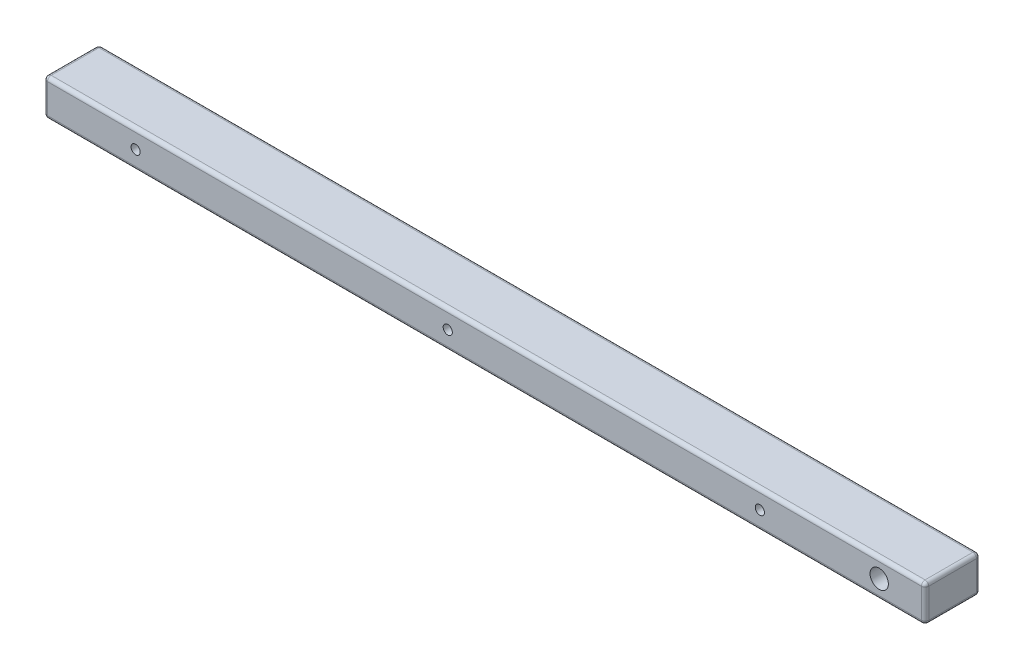
from build123d import *

# Parameters (mm, degrees)
SKETCH1_W           = 480
SKETCH1_H           = 20
BOSS_EXTRUDE1_DEPTH = 30
FILLET1_R           = 2
SKETCH2_R           = 5
CUT_EXTRUDE1_DEPTH  = 30
SKETCH7_R           = 2.5
CUT_EXTRUDE4_DEPTH  = 30


with BuildPart() as part:
    # Sketch1 → Boss-Extrude1 (new body)
    with BuildSketch(Plane.XY):
        with Locations((0, 10)):
            Rectangle(SKETCH1_W, SKETCH1_H)
    extrude(amount=BOSS_EXTRUDE1_DEPTH)

    # Fillet1
    fillet1_edges = [part.edges().sort_by_distance(p)[0] for p in [
        (240, 10, 30),
        (0, 20, 30),
        (-240, 10, 30),
        (0, 20, 0),
        (240, 10, 0),
        (0, 0, 0),
        (-240, 10, 0),
        (-240, 20, 15),
        (240, 20, 15),
        (240, 0, 15),
        (-240, 0, 15),
        (0, 0, 30),
    ]]
    fillet(fillet1_edges, radius=FILLET1_R)

    # Sketch2 → Cut-Extrude1 (cut)
    with BuildSketch(Plane(origin=(0, 0, 0), x_dir=(-1, 0, 0), z_dir=(0, 0, -1))):
        with Locations((-215, 10)):
            Circle(SKETCH2_R)
    extrude(amount=-CUT_EXTRUDE1_DEPTH, mode=Mode.SUBTRACT)

    # Sketch7 → Cut-Extrude4 (cut)
    with BuildSketch(Plane(origin=(0, 0, 0), x_dir=(-1, 0, 0), z_dir=(0, 0, -1))):
        with Locations((-150, 10)):
            Circle(SKETCH7_R)
        with Locations((20, 10)):
            Circle(SKETCH7_R)
        with Locations((190, 10)):
            Circle(SKETCH7_R)
    extrude(amount=-CUT_EXTRUDE4_DEPTH, mode=Mode.SUBTRACT)


solid = part.part
